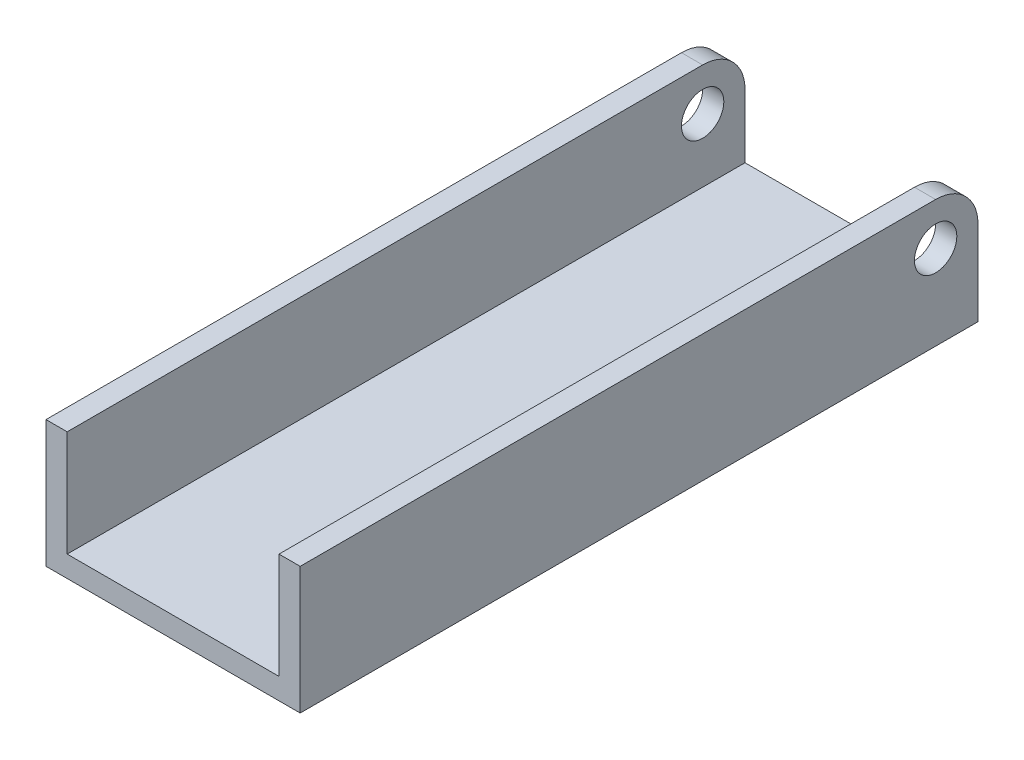
from build123d import *

# Parameters (mm, degrees)
BOSS_EXTRUDE1_DEPTH          = 50.8
F_1_8_0_125_DIAMETER_HOLE1_D = 3.175
FILLET2_R                    = 3.175


with BuildPart() as part:
    # Sketch1 → Boss-Extrude1 (new body)
    with BuildSketch(Plane.XY):
        Polygon((17.4625, 9.525), (17.4625, 1.5875), (1.5875, 1.5875), (1.5875, 9.525), (0, 9.525), (0, 0), (19.05, 0), (19.05, 9.525), align=None)
    extrude(amount=BOSS_EXTRUDE1_DEPTH)

    # 1/8 (0.125) Diameter Hole1 (through all)
    with Locations(Plane(origin=(19.05, 0, 0), x_dir=(0, 0, -1), z_dir=(1, 0, 0))):
        with Locations((-3.175, 6.35)):
            Hole(F_1_8_0_125_DIAMETER_HOLE1_D / 2)

    # Fillet2
    fillet2_edges = [part.edges().sort_by_distance(p)[0] for p in [
        (0.79375, 9.525, 0),
        (18.25625, 9.525, 0),
    ]]
    fillet(fillet2_edges, radius=FILLET2_R)


solid = part.part
